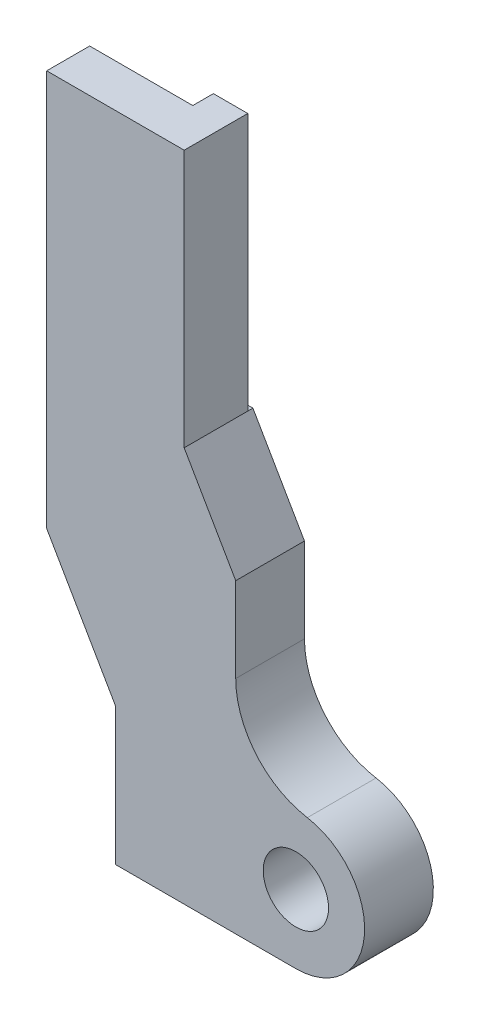
from build123d import *

# Parameters (mm, degrees)
SKETCH_1_R          = 1.9
EXTRUDE_1_DEPTH     = 4
SKETCH_2_W          = 3
SKETCH_2_H          = 1.5
CUT_EXTRUDE_1_DEPTH = 14.793114224
SKETCH_3_W          = 1
SKETCH_3_H          = 8
EXTRUDE_2_DEPTH     = 1
SKETCH_4_W          = 5.5
SKETCH_4_H          = 30
EXTRUDE_3_DEPTH     = 2.5
EXTRUDE_4_DEPTH     = 15
SKETCH_6_W          = 2
SKETCH_6_H          = 1.2
EXTRUDE_5_DEPTH     = 15
EXTRUDE_6_REACH     = 37.672
CUT_EXTRUDE_2_REACH = 37.809
EXTRUDE_7_DEPTH     = 2.5
EXTRUDE_8_REACH     = 39.047
SKETCH_11_W         = 1.5
SKETCH_11_H         = 10
CUT_EXTRUDE_3_DEPTH = 2.5
CUT_EXTRUDE_4_REACH = 35.56
SKETCH_12_W         = 1
SKETCH_12_H         = 1
FILLET_1_R          = 5


with BuildPart() as part:
    # 草图1 → 凸台-拉伸1 (new body)
    with BuildSketch(Plane.XY):
        with BuildLine():
            Line((0, 4), (-10.5, 4))
            Line((-10.5, 4), (-10.5, -4))
            Line((-10.5, -4), (0, -4))
            ThreePointArc((0, -4), (4, 0), (0, 4))
        make_face()
        Circle(SKETCH_1_R, mode=Mode.SUBTRACT)
    extrude(amount=EXTRUDE_1_DEPTH)

    # 草图2 → 切除-拉伸1 (cut, through all)
    with BuildSketch(Plane(origin=(0, 4, 0), x_dir=(1, 0, 0), z_dir=(0, 1, 0))):
        with Locations((-6, -0.75)):
            Rectangle(SKETCH_2_W, SKETCH_2_H)
    extrude(amount=-CUT_EXTRUDE_1_DEPTH, mode=Mode.SUBTRACT)

    # 草图3 → 凸台-拉伸2 (add)
    with BuildSketch(Plane(origin=(0, 0, 0), x_dir=(-1, 0, 0), z_dir=(0, 0, -1))):
        with Locations((10, 0)):
            Rectangle(SKETCH_3_W, SKETCH_3_H)
    extrude(amount=EXTRUDE_2_DEPTH)

    # 草图4 → 凸台-拉伸3 (add)
    with BuildSketch(Plane.XY.offset(4)):
        with Locations((-7.75, 19)):
            Rectangle(SKETCH_4_W, SKETCH_4_H)
    extrude(amount=-EXTRUDE_3_DEPTH)

    # 草图5 → 凸台-拉伸4 (add)
    with BuildSketch(Plane(origin=(0, 4, 0), x_dir=(1, 0, 0), z_dir=(0, 1, 0))):
        Polygon((-5, -4), (-3.5, -4), (-3.5, 0), (-4.5, 0), (-4.5, -1.5), (-5, -1.5), align=None)
    extrude(amount=EXTRUDE_4_DEPTH)

    # 草图6 → 凸台-拉伸5 (add)
    with BuildSketch(Plane(origin=(0, 19, 0), x_dir=(1, 0, 0), z_dir=(0, 1, 0))):
        with Locations((-7.5, -0.9)):
            Rectangle(SKETCH_6_W, SKETCH_6_H)
    extrude(amount=EXTRUDE_5_DEPTH)

    # 凸台-拉伸6: up to this face of the body (flat: up to its plane)
    extrude_6_end = Plane(part.part.faces().sort_by_distance((-8.5, 0, 0))[0])
    # 草图7 → 凸台-拉伸6 (add, up to the picked face)
    with BuildSketch(Plane(origin=(0, 0, 1.5), x_dir=(-1, 0, 0), z_dir=(0, 0, -1)), mode=Mode.PRIVATE) as extrude_6_sk1:
        Polygon((8.5, 19), (4.5, 12.07179677), (4.5, 19), align=None)
    extrude_6_tool1 = split(extrude(extrude_6_sk1.sketch, amount=EXTRUDE_6_REACH, mode=Mode.PRIVATE), bisect_by=extrude_6_end, keep=Keep.BOTH, mode=Mode.PRIVATE)
    add(extrude_6_tool1.solids().sort_by(Axis((-5.833333, 16.690599, 1.5), (0, 0, -1)))[0])

    # 草图8 → 切除-拉伸2 (cut, up to next)
    with BuildSketch(Plane(origin=(0, 0, 0), x_dir=(-1, 0, 0), z_dir=(0, 0, -1)), mode=Mode.PRIVATE) as cut_extrude_2_sk1:
        Polygon((6.5, 34), (6.5, 19), (3.5, 13.803847577), (3.5, 19), (5, 19), (5, 34), align=None)
    cut_extrude_2_tool1 = extrude(cut_extrude_2_sk1.sketch, amount=-CUT_EXTRUDE_2_REACH, mode=Mode.PRIVATE) & part.part
    add(cut_extrude_2_tool1.solids().sort_by_distance((-5.428395, 24.124739, 0))[0], mode=Mode.SUBTRACT)

    # 草图9 → 凸台-拉伸7 (add)
    with BuildSketch(Plane.XY.offset(4)):
        Polygon((-10.5, 34), (-14.5, 34), (-14.5, 10.92820323), (-10.5, 4), align=None)
    extrude(amount=-EXTRUDE_7_DEPTH)

    # 凸台-拉伸8: up to this face of the body (flat: up to its plane)
    extrude_8_end = Plane(part.part.faces().sort_by_distance((-10, 0, -1))[0])
    # 草图10 → 凸台-拉伸8 (add, up to the picked face)
    with BuildSketch(Plane(origin=(0, 0, 1.5), x_dir=(-1, 0, 0), z_dir=(0, 0, -1)), mode=Mode.PRIVATE) as extrude_8_sk1:
        Polygon((8.5, 4), (13, 11.794228634), (13, 34), (14.5, 34), (14.5, 10.92820323), (10.5, 4), align=None)
    extrude_8_tool1 = split(extrude(extrude_8_sk1.sketch, amount=EXTRUDE_8_REACH, mode=Mode.PRIVATE), bisect_by=extrude_8_end, keep=Keep.BOTH, mode=Mode.PRIVATE)
    add(extrude_8_tool1.solids().sort_by(Axis((-13.105485, 18.144493, 1.5), (0, 0, -1)))[0])

    # 草图11 → 切除-拉伸3 (cut)
    with BuildSketch(Plane(origin=(0, 0, -1), x_dir=(-1, 0, 0), z_dir=(0, 0, -1))):
        with Locations((13.75, 29)):
            Rectangle(SKETCH_11_W, SKETCH_11_H)
    extrude(amount=-CUT_EXTRUDE_3_DEPTH, mode=Mode.SUBTRACT)

    # 切除-拉伸4: up to this face of the body (flat: up to its plane)
    cut_extrude_4_end = Plane(part.part.faces().sort_by_distance((-10.75, 7.897114317, 0.25))[0])
    # 草图12 → 切除-拉伸4 (cut, up to the picked face)
    with BuildSketch(Plane.XZ.offset(-4), mode=Mode.PRIVATE) as cut_extrude_4_sk1:
        with Locations((-9, -0.5)):
            Rectangle(SKETCH_12_W, SKETCH_12_H)
    cut_extrude_4_tool1 = split(extrude(cut_extrude_4_sk1.sketch, amount=-CUT_EXTRUDE_4_REACH, mode=Mode.PRIVATE), bisect_by=cut_extrude_4_end, keep=Keep.BOTH, mode=Mode.PRIVATE)
    add(cut_extrude_4_tool1.solids().sort_by(Axis((-9, 4, -0.5), (0, 1, 0)))[0], mode=Mode.SUBTRACT)

    # 圆角1
    fillet_1_edges = [part.edges().sort_by_distance(p)[0] for p in [
        (-3.5, 4, 2),
    ]]
    fillet(fillet_1_edges, radius=FILLET_1_R)


solid = part.part
